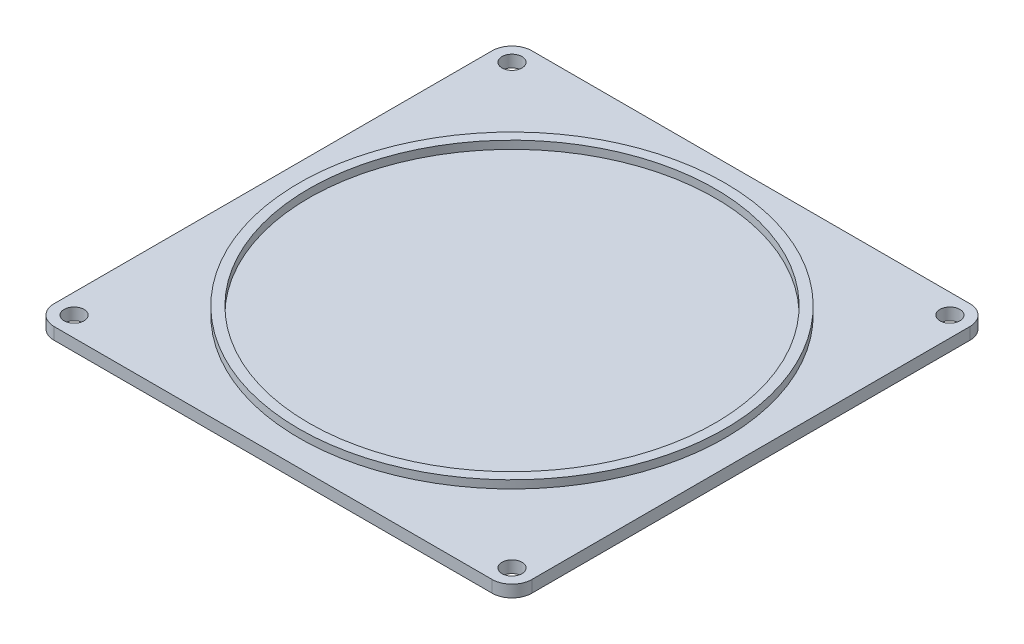
from build123d import *

# Parameters (mm, degrees)
SKETCH1_W           = 120
SKETCH1_H           = 120
BOSS_EXTRUDE1_DEPTH = 3
SKETCH2_R           = 53.5
SKETCH2_R_2         = 51
BOSS_EXTRUDE2_DEPTH = 2
SKETCH3_R           = 2.5
CUT_EXTRUDE1_DEPTH  = 3
FILLET2_R           = 5


with BuildPart() as part:
    # Sketch1 → Boss-Extrude1 (new body)
    with BuildSketch(Plane(origin=(0, 0, 0), x_dir=(1, 0, 0), z_dir=(0, 1, 0))):
        Rectangle(SKETCH1_W, SKETCH1_H)
    extrude(amount=BOSS_EXTRUDE1_DEPTH)

    # Sketch2 → Boss-Extrude2 (add)
    with BuildSketch(Plane(origin=(0, 3, 0), x_dir=(1, 0, 0), z_dir=(0, 1, 0))):
        with Locations(Location((0, 0, 0), (0, 0, 90))):
            Circle(SKETCH2_R)
        with Locations(Location((0, 0, 0), (0, 0, 270))):
            Circle(SKETCH2_R_2, mode=Mode.SUBTRACT)
    extrude(amount=BOSS_EXTRUDE2_DEPTH)

    # Sketch3 → Cut-Extrude1 (cut)
    with BuildSketch(Plane(origin=(0, 3, 0), x_dir=(1, 0, 0), z_dir=(0, 1, 0))):
        with Locations(Location((-55, 55, 0), (0, 0, 270))):
            Circle(SKETCH3_R)
        with Locations(Location((55, 55, 0), (0, 0, 90))):
            Circle(SKETCH3_R)
        with Locations(Location((-55, -55, 0), (0, 0, 90))):
            Circle(SKETCH3_R)
        with Locations(Location((55, -55, 0), (0, 0, 270))):
            Circle(SKETCH3_R)
    extrude(amount=-CUT_EXTRUDE1_DEPTH, mode=Mode.SUBTRACT)

    # Fillet2
    fillet2_edges = [part.edges().sort_by_distance(p)[0] for p in [
        (60, 1.5, 60),
        (-60, 1.5, 60),
        (-60, 1.5, -60),
        (60, 1.5, -60),
    ]]
    fillet(fillet2_edges, radius=FILLET2_R)


solid = part.part
